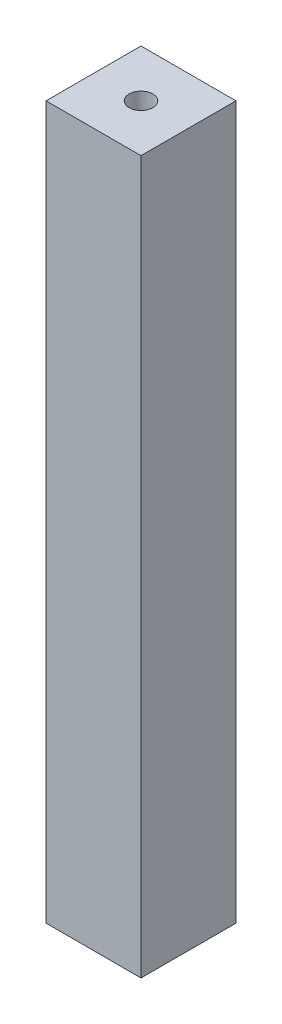
from build123d import *

# Parameters (mm, degrees)
SKETCH2_W           = 20
SKETCH2_H           = 20
SKETCH2_R           = 2.5
BOSS_EXTRUDE1_DEPTH = 150


with BuildPart() as part:
    # Sketch2 → Boss-Extrude1 (new body)
    with BuildSketch(Plane(origin=(0, 0, 0), x_dir=(1, 0, 0), z_dir=(0, 1, 0))):
        Rectangle(SKETCH2_W, SKETCH2_H)
        with Locations(Location((0, 0, 0), (0, 0, 270))):
            Circle(SKETCH2_R, mode=Mode.SUBTRACT)
    extrude(amount=BOSS_EXTRUDE1_DEPTH)


solid = part.part
